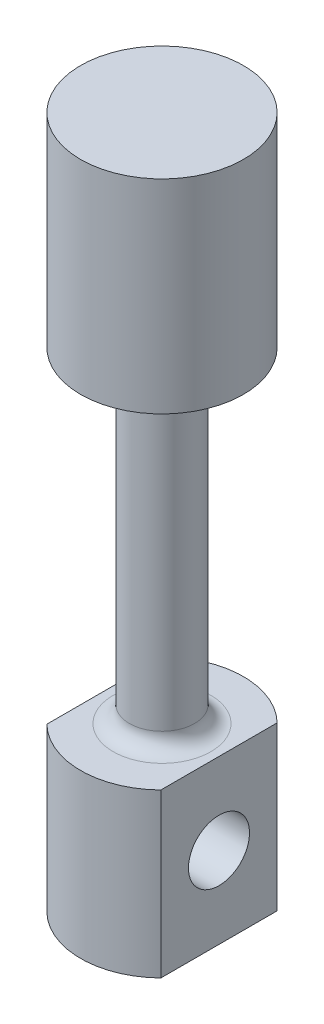
from build123d import *

# Parameters (mm, degrees)
SKETCH1_R                      = 6.35
BOSS_EXTRUDE1_DEPTH            = 53.975
SKETCH3_W                      = 13.824388351
SKETCH3_H                      = 22.988870516
CUT_EXTRUDE1_DEPTH             = 55.716959208
F_3_16_0_1875_DIAMETER_HOLE1_D = 4.7625


with BuildPart() as part:
    # Sketch1 → Boss-Extrude1 (new body)
    with BuildSketch(Plane(origin=(0, 0, 0), x_dir=(1, 0, 0), z_dir=(0, 1, 0))):
        with Locations(Location((0, 0, 0), (0, 0, 270))):
            Circle(SKETCH1_R)
    extrude(amount=BOSS_EXTRUDE1_DEPTH)

    # Sketch2 → Cut-Revolve1 (revolve, cut)
    with BuildSketch(Plane.XY, mode=Mode.PRIVATE) as cut_revolve1_sk:
        with BuildLine():
            Line((26.057124612, 38.1), (3.81, 38.1))
            ThreePointArc((3.81, 38.1), (2.911974388, 37.728025612), (2.54, 36.83))
            Line((2.54, 36.83), (2.54, 13.97))
            ThreePointArc((2.54, 13.97), (2.911974388, 13.071974388), (3.81, 12.7))
            Line((3.81, 12.7), (26.057124612, 12.7))
            Line((26.057124612, 12.7), (26.057124612, 38.1))
        make_face()
    revolve(cut_revolve1_sk.sketch.rotate(Axis((0, 0, 0), (0, 1, 0)), 90), axis=Axis((0, 0, 0), (0, 1, 0)), mode=Mode.SUBTRACT)

    # Sketch3 → Cut-Extrude1 (cut, symmetric)
    with BuildSketch(Plane.XY):
        with Locations((11.357194176, 7.862043189)):
            Rectangle(SKETCH3_W, SKETCH3_H)
    cut_extrude1 = extrude(amount=CUT_EXTRUDE1_DEPTH, both=True, mode=Mode.SUBTRACT)

    # Mirror1: Cut-Extrude1 across plane
    add(cut_extrude1.mirror(Plane(origin=(0, 0, 0), x_dir=(0, 0, 1), z_dir=(1, 0, 0))), mode=Mode.SUBTRACT)

    # 3/16 (0.1875) Diameter Hole1 (through all)
    with Locations(Plane.ZY.offset(4.445)):
        with Locations((0, 6.35)):
            Hole(F_3_16_0_1875_DIAMETER_HOLE1_D / 2)


solid = part.part
